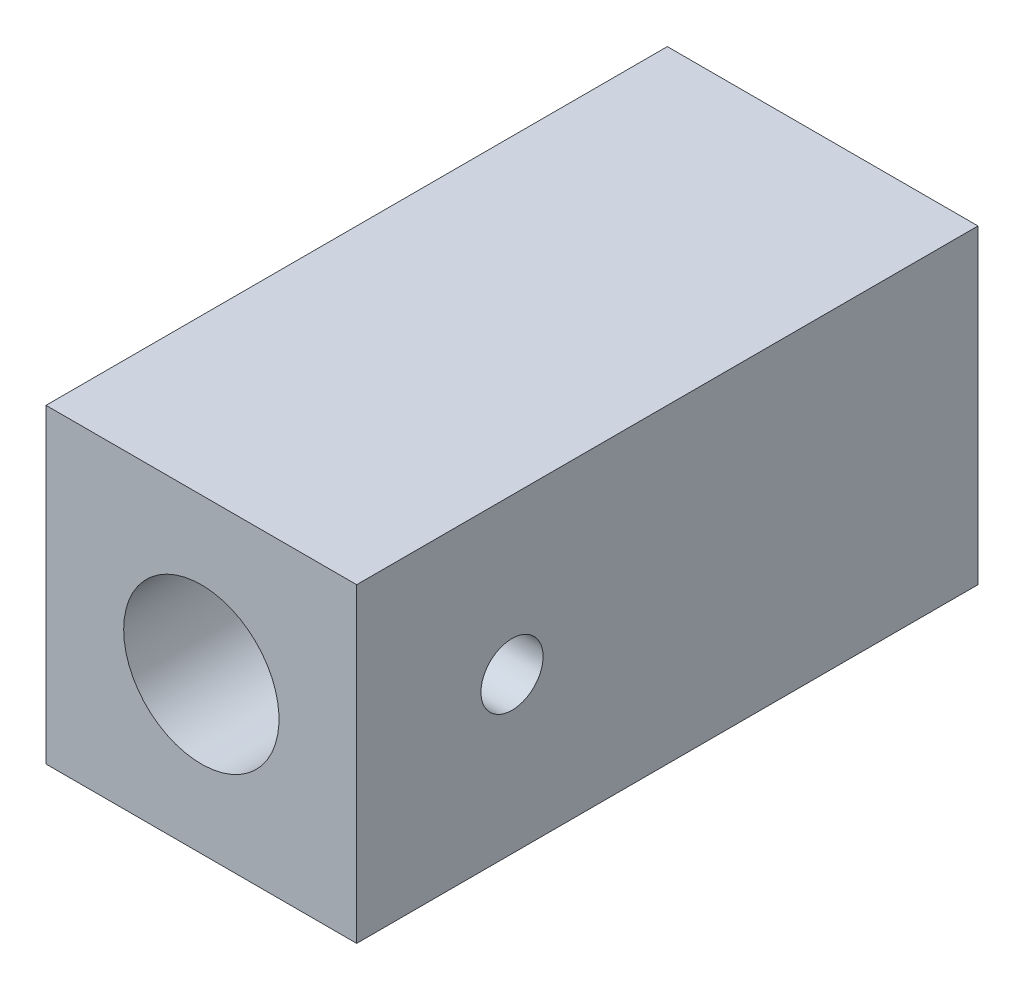
from build123d import *

# Parameters (mm, degrees)
SKETCH_1_W          = 10
SKETCH_1_H          = 10
EXTRUDE_1_DEPTH     = 10
SKETCH_2_R          = 2.5
EXTRUDE_2_DEPTH     = 5
SKETCH_3_R          = 1
EXTRUDE_3_DEPTH     = 5
CUT_EXTRUDE_START   = -30
SKETCH_4_R          = 2.5
CUT_EXTRUDE_1_DEPTH = 30
SKETCH_5_R          = 1
CUT_EXTRUDE_2_DEPTH = 30
SKETCH_9_W          = 10
SKETCH_9_H          = 10
EXTRUDE_5_DEPTH     = 10
SKETCH_10_R         = 2
CUT_EXTRUDE_4_DEPTH = 20


with BuildPart() as part:
    # 草图1 → 凸台-拉伸1 (new body)
    with BuildSketch(Plane.XY):
        Rectangle(SKETCH_1_W, SKETCH_1_H)
    extrude(amount=EXTRUDE_1_DEPTH)

    # 草图2 → 凸台-拉伸2 (add)
    with BuildSketch(Plane.XY.offset(10)):
        Circle(SKETCH_2_R)
    extrude(amount=EXTRUDE_2_DEPTH)

    # 草图3 → 凸台-拉伸3 (add)
    with BuildSketch(Plane(origin=(5, 0, 0), x_dir=(0, 0, -1), z_dir=(1, 0, 0))):
        with Locations(Location((-5, 0, 0), (0, 0, 270))):
            Circle(SKETCH_3_R)
    extrude(amount=EXTRUDE_3_DEPTH)

    # 草图4 → 切除-拉伸1 (cut)
    with BuildSketch(Plane.XY.offset(15).offset(CUT_EXTRUDE_START)):
        with Locations(Location((0, 0, 0), (0, 0, 180))):
            Circle(SKETCH_4_R)
    extrude(amount=CUT_EXTRUDE_1_DEPTH, mode=Mode.SUBTRACT)

    # 草图5 → 切除-拉伸2 (cut)
    with BuildSketch(Plane(origin=(10, 0, 0), x_dir=(0, 0, -1), z_dir=(1, 0, 0)).offset(CUT_EXTRUDE_START)):
        with Locations((-5, 0)):
            Circle(SKETCH_5_R)
    extrude(amount=CUT_EXTRUDE_2_DEPTH, mode=Mode.SUBTRACT)

    # 草图9 → 凸台-拉伸5 (add)
    with BuildSketch(Plane(origin=(0, 0, 0), x_dir=(-1, 0, 0), z_dir=(0, 0, -1))):
        Rectangle(SKETCH_9_W, SKETCH_9_H)
    extrude(amount=EXTRUDE_5_DEPTH)

    # 草图10 → 切除-拉伸4 (cut)
    with BuildSketch(Plane(origin=(0, 0, -10), x_dir=(-1, 0, 0), z_dir=(0, 0, -1))):
        Circle(SKETCH_10_R)
    extrude(amount=-CUT_EXTRUDE_4_DEPTH, mode=Mode.SUBTRACT)


solid = part.part
